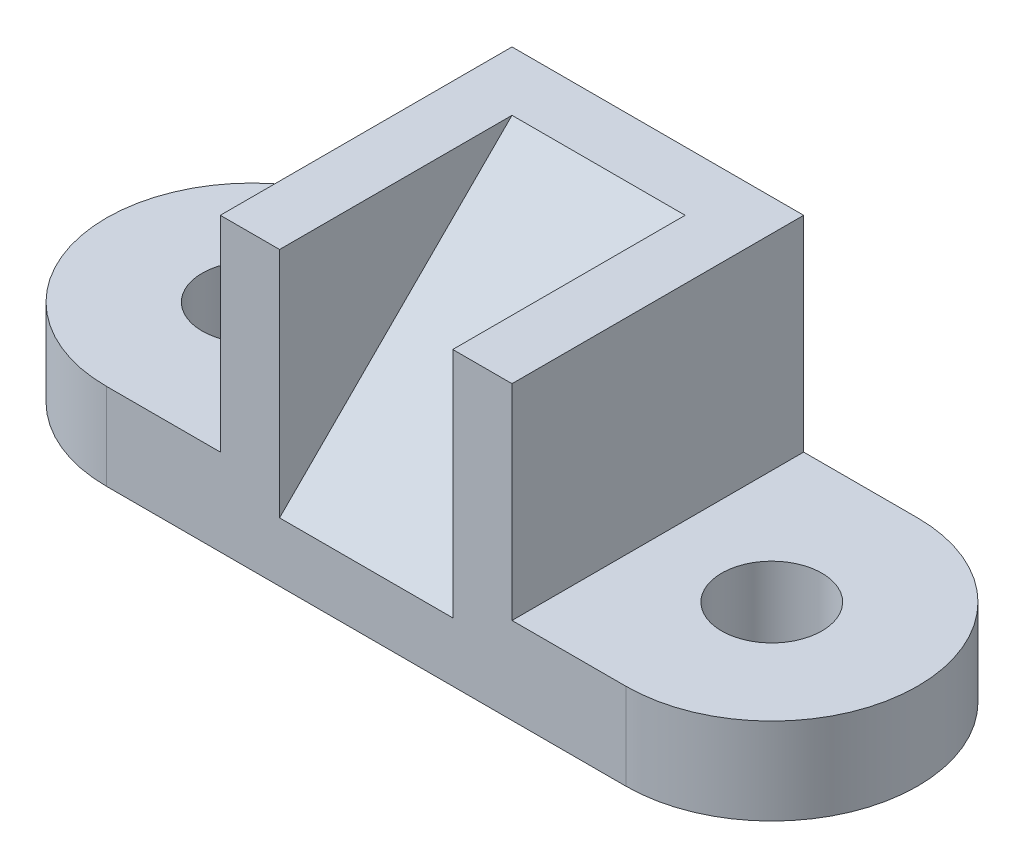
from build123d import *

# Parameters (mm, degrees)
SKETCH1_R           = 11
BOSS_EXTRUDE2_DEPTH = 19
SKETCH2_W           = 64
SKETCH2_H           = 64
BOSS_EXTRUDE3_DEPTH = 45
CUT_EXTRUDE1_START  = -13
CUT_EXTRUDE1_DEPTH  = 38


with BuildPart() as part:
    # Sketch1 → Boss-Extrude2 (new body)
    with BuildSketch(Plane(origin=(0, 0, 0), x_dir=(1, 0, 0), z_dir=(0, 1, 0))):
        with BuildLine():
            Line((0, 0), (114, 0))
            ThreePointArc((114, 0), (146, 32), (114, 64))
            Line((114, 64), (0, 64))
            ThreePointArc((0, 64), (-32, 32), (0, 0))
        make_face()
        with Locations(Location((0, 32, 0), (0, 0, 270))):
            Circle(SKETCH1_R, mode=Mode.SUBTRACT)
        with Locations(Location((114, 32, 0), (0, 0, 270))):
            Circle(SKETCH1_R, mode=Mode.SUBTRACT)
    extrude(amount=BOSS_EXTRUDE2_DEPTH)

    # Sketch2 → Boss-Extrude3 (add)
    with BuildSketch(Plane(origin=(0, 19, 0), x_dir=(1, 0, 0), z_dir=(0, 1, 0))):
        with Locations((57, 32)):
            Rectangle(SKETCH2_W, SKETCH2_H)
    extrude(amount=BOSS_EXTRUDE3_DEPTH)

    # Sketch3 → Cut-Extrude1 (cut)
    with BuildSketch(Plane.ZY.offset(-25).offset(CUT_EXTRUDE1_START)):
        Polygon((0, 13), (0, 64), (-51, 64), align=None)
    extrude(amount=-CUT_EXTRUDE1_DEPTH, mode=Mode.SUBTRACT)


solid = part.part
